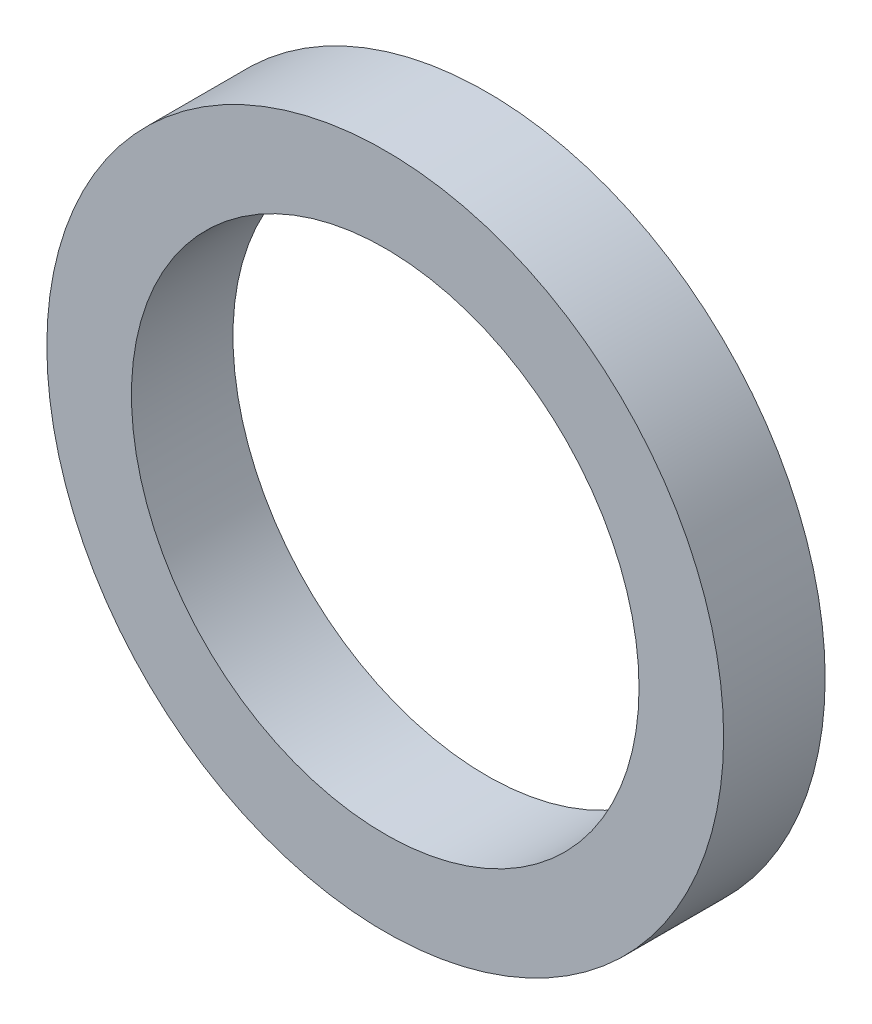
from build123d import *

# Parameters (mm, degrees)
SKETCH1_R           = 100
SKETCH1_R_2         = 75
BOSS_EXTRUDE1_DEPTH = 30


with BuildPart() as part:
    # Sketch1 → Boss-Extrude1 (new body)
    with BuildSketch(Plane.XY):
        Circle(SKETCH1_R)
        Circle(SKETCH1_R_2, mode=Mode.SUBTRACT)
    extrude(amount=BOSS_EXTRUDE1_DEPTH)


solid = part.part
